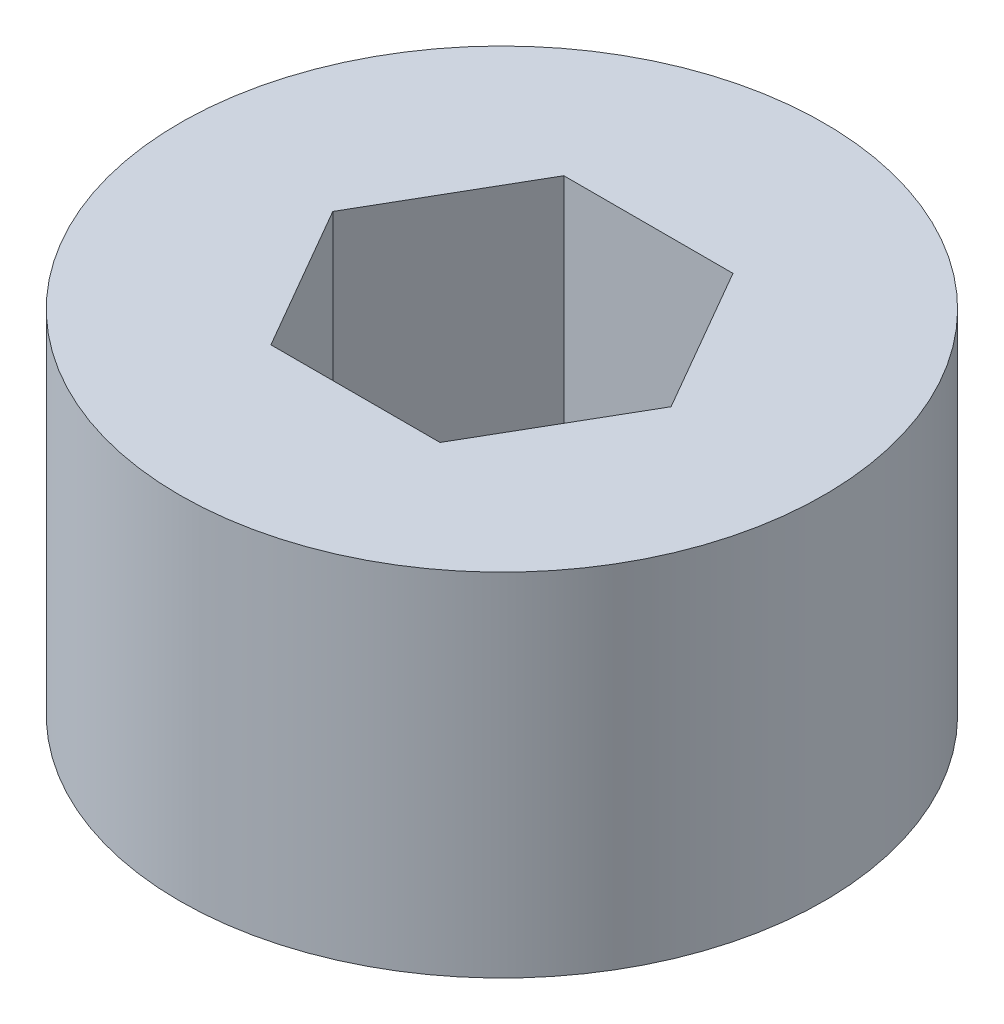
from build123d import *

# Parameters (mm, degrees)
SKETCH1_R           = 2.75
BOSS_EXTRUDE1_DEPTH = 3
BOSS_EXTRUDE2_DEPTH = 3
CUT_EXTRUDE3_DEPTH  = 3.981121947


with BuildPart() as part:
    # Sketch1 → Boss-Extrude1 (new body)
    with BuildSketch(Plane(origin=(0, 0, 0), x_dir=(1, 0, 0), z_dir=(0, 1, 0))):
        Circle(SKETCH1_R)
    extrude(amount=BOSS_EXTRUDE1_DEPTH)

    # Sketch2 → Boss-Extrude2 (add)
    with BuildSketch(Plane(origin=(0, 0, 0), x_dir=(1, 0, 0), z_dir=(0, 1, 0))):
        Polygon((0.721687836, 1.25), (-0.721687836, 1.25), (-1.443375673, 0), (-0.721687836, -1.25), (0.721687836, -1.25), (1.443375673, 0), align=None)
    extrude(amount=BOSS_EXTRUDE2_DEPTH)

    # Sketch2<2> → Cut-Extrude3 (cut)
    with BuildSketch(Plane(origin=(0, 0, 0), x_dir=(1, 0, 0), z_dir=(0, 1, 0))):
        Polygon((0.721687836, 1.25), (-0.721687836, 1.25), (-1.443375673, 0), (-0.721687836, -1.25), (0.721687836, -1.25), (1.443375673, 0), align=None)
    extrude(amount=CUT_EXTRUDE3_DEPTH, mode=Mode.SUBTRACT)


solid = part.part
